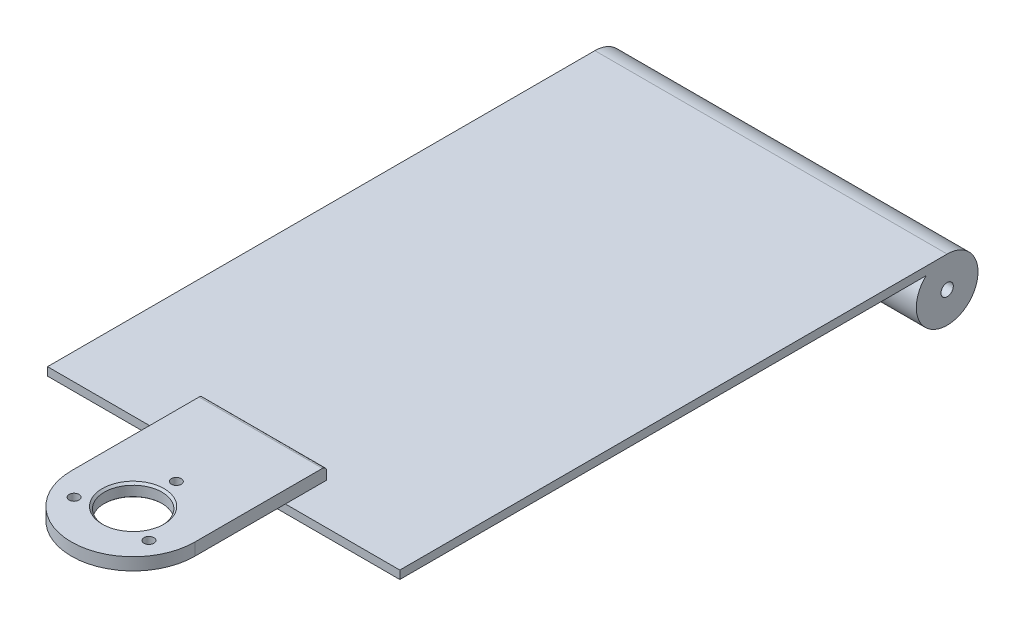
from build123d import *

# Parameters (mm, degrees)
SKETCH1_R           = 1.5
BOSS_EXTRUDE1_DEPTH = 42.8
BOSS_EXTRUDE2_DEPTH = 3
BOSS_EXTRUDE3_DEPTH = 30
CUT_EXTRUDE1_REACH  = 178.227
SKETCH4_R           = 7.000000000000002
SKETCH5_R           = 1.200000000000002
SKETCH5_R_2         = 1.199999999999986
SKETCH5_R_3         = 1.2000000000000053
CUT_EXTRUDE2_DEPTH  = 0.1
CIRPATTERN1_COUNT   = 3


with BuildPart() as part:
    # Sketch1 → Boss-Extrude1 (new, symmetric)
    with BuildSketch(Plane(origin=(0, 0, 0), x_dir=(0, 0, -1), z_dir=(1, 0, 0))):
        with BuildLine():
            Line((-9.2e-16, 7.500000000000001), (-133, 7.499999999999983))
            Line((-133, 7.499999999999983), (-133, 5.499999999999983))
            Line((-133, 5.499999999999983), (-5.099019513592791, 5.499999999999995))
            ThreePointArc((-5.099019513592791, 5.499999999999995), (2.738612787525835, -6.982120021884469), (-9.2e-16, 7.500000000000001))
        make_face()
        Circle(SKETCH1_R, mode=Mode.SUBTRACT)
    extrude(amount=BOSS_EXTRUDE1_DEPTH, both=True)



with BuildPart() as body_2:
    # Sketch2 → Boss-Extrude2 (new body)
    with BuildSketch(Plane(origin=(0, 7.500000000000001, 9.8e-16), x_dir=(1, 0, 0), z_dir=(0, 1, 1.3e-16))):
        with BuildLine():
            Line((15.000000000000007, -155), (15.000000000000007, -133))
            Line((15.000000000000007, -133), (-15.000000000000007, -133))
            Line((-15.000000000000007, -133), (-15.000000000000007, -155))
            ThreePointArc((-15.000000000000007, -155), (-2.76e-15, -170), (15.000000000000007, -155))
        make_face()
    extrude(amount=BOSS_EXTRUDE2_DEPTH)


with BuildPart() as part_1:
    add(part.part)

    add(body_2.part)  # Boss-Extrude3 merges body 2
    # Sketch3 → Boss-Extrude3 (add)
    with BuildSketch(Plane(origin=(15.000000000000007, 0, 0), x_dir=(0, 0, -1), z_dir=(1, 0, 0))):
        with BuildLine():
            Line((-133, 10.499999999999984), (-133, 7.499999999999983))
            Line((-133, 7.499999999999983), (-123.00000000000001, 7.500000000000002))
            Line((-123.00000000000001, 7.500000000000002), (-123.00000000000001, 9.499999999999975))
            ThreePointArc((-123.00000000000001, 9.499999999999975), (-123.29289321881346, 10.207106781186528), (-124.00000000000001, 10.499999999999984))
            Line((-124.00000000000001, 10.499999999999984), (-133, 10.499999999999984))
        make_face()
    extrude(amount=-BOSS_EXTRUDE3_DEPTH)

    # Sketch4 → Cut-Extrude1 (cut, up to next)
    with BuildSketch(Plane(origin=(0, 10.499999999999984, 0), x_dir=(1, 0, 0), z_dir=(0, 1, 0)), mode=Mode.PRIVATE) as cut_extrude1_sk1:
        with Locations(Location((0, -155, 0), (0, 0, 270))):
            Circle(SKETCH4_R)
    cut_extrude1_tool1 = extrude(cut_extrude1_sk1.sketch, amount=-CUT_EXTRUDE1_REACH, mode=Mode.PRIVATE) & part_1.part
    add(cut_extrude1_tool1.solids().sort_by_distance((0, 10.5, 155))[0], mode=Mode.SUBTRACT)

    # Sketch5 → Cut-Extrude2 (cut)
    with BuildSketch(Plane(origin=(0, 10.499999999999984, 0), x_dir=(1, 0, 0), z_dir=(0, 1, 0))):
        with Locations(Location((0, -144.5, 0), (0, 0, 270))):
            Circle(SKETCH5_R)
        with Locations(Location((9.093266739737038, -160.24999999999977, 0), (0, 0, 270))):
            Circle(SKETCH5_R_2)
        with Locations(Location((-9.093266739736205, -160.25000000000017, 0), (0, 0, 270))):
            Circle(SKETCH5_R_3)
    extrude(amount=-CUT_EXTRUDE2_DEPTH, mode=Mode.SUBTRACT)

    # Sketch6 → Cut-Revolve1 (revolve, cut)
    with BuildSketch(Plane(origin=(0, 0, 0), x_dir=(0, 0, -1), z_dir=(1, 0, 0)), mode=Mode.PRIVATE) as cut_revolve1_sk:
        Polygon((-144.5, 7.499999999999982), (-142, 7.4999999999999805), (-143.29999999999998, 8.799999999999951), (-143.29999999999998, 9.799999999999965), (-143.29999999999998, 10.499999999999984), (-144.5, 10.499999999999984), align=None)
    cut_revolve1 = revolve(cut_revolve1_sk.sketch.rotate(Axis((0, 10.499999999999984, 144.5), (0, -1, 0)), 180), axis=Axis((0, 10.499999999999984, 144.5), (0, -1, 0)), mode=Mode.SUBTRACT)

    # CirPattern1: Cut-Revolve1 ×3 about axis
    cirpattern1_axis = Axis((-4.63e-15, 0, 155), (0, 1, 0))
    for i in range(1, CIRPATTERN1_COUNT):
        add(cut_revolve1.rotate(cirpattern1_axis, i * 360 / CIRPATTERN1_COUNT), mode=Mode.SUBTRACT)

    # Sketch7 → Cut-Revolve2 (revolve, cut)
    with BuildSketch(Plane(origin=(0, 0, 0), x_dir=(0, 0, -1), z_dir=(1, 0, 0))):
        Polygon((-148, 7.499999999999981), (-147.9, 7.499999999999981), (-148, 7.599999999999977), align=None)
        Polygon((-148, 10.499999999999984), (-147.5, 10.499999999999984), (-148, 9.99999999999998), (-155, 9.99999999999998), (-155, 10.499999999999984), align=None)
    revolve(axis=Axis((0, 7.4999999999999805, 155), (0, 1, 0)), mode=Mode.SUBTRACT)


solid = part_1.part
